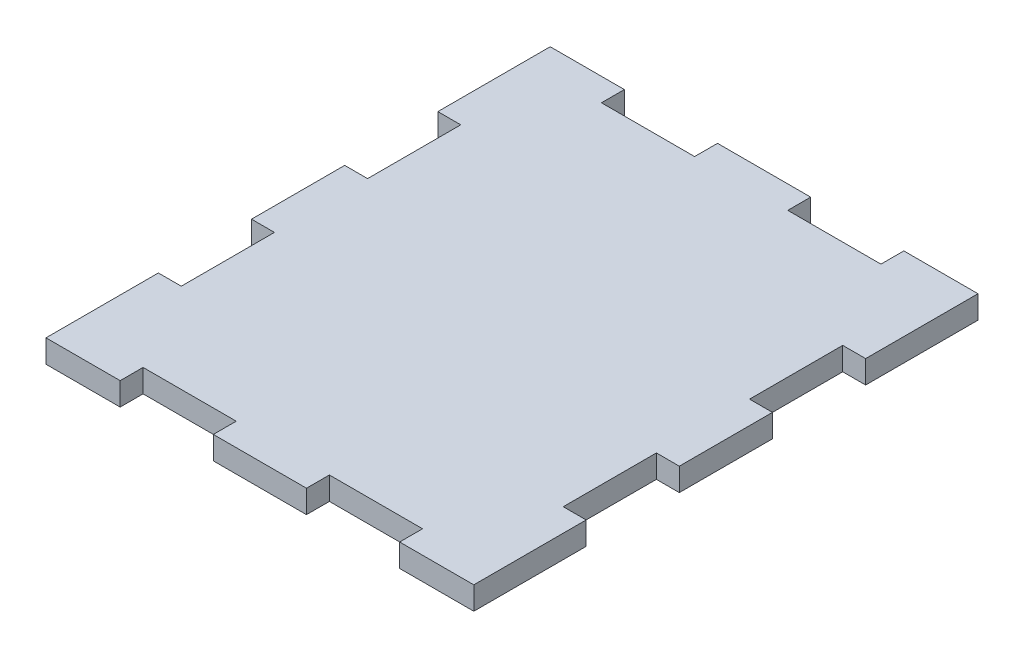
from build123d import *

# Parameters (mm, degrees)
BOSS_EXTRUDE1_DEPTH = 6


with BuildPart() as part:
    # Sketch2 → Boss-Extrude1 (new body)
    with BuildSketch(Plane(origin=(0, 0, 0), x_dir=(1, 0, 0), z_dir=(0, 1, 0))):
        Polygon((0, 270), (0, 240.585), (6, 240.585), (6, 216.195), (0, 216.195), (0, 191.805), (6, 191.805), (6, 167.415), (0, 167.415), (0, 143.025), (0, 138), (19.415, 138), (19.415, 144), (43.805, 144), (43.805, 138), (68.195, 138), (68.195, 144), (92.585, 144), (92.585, 138), (112, 138), (112, 167.415), (106, 167.415), (106, 191.805), (112, 191.805), (112, 216.195), (106, 216.195), (106, 240.585), (112, 240.585), (112, 264.975), (112, 270), (92.585, 270), (92.585, 264), (68.195, 264), (68.195, 270), (43.805, 270), (43.805, 264), (19.415, 264), (19.415, 270), align=None)
    extrude(amount=BOSS_EXTRUDE1_DEPTH)


solid = part.part
